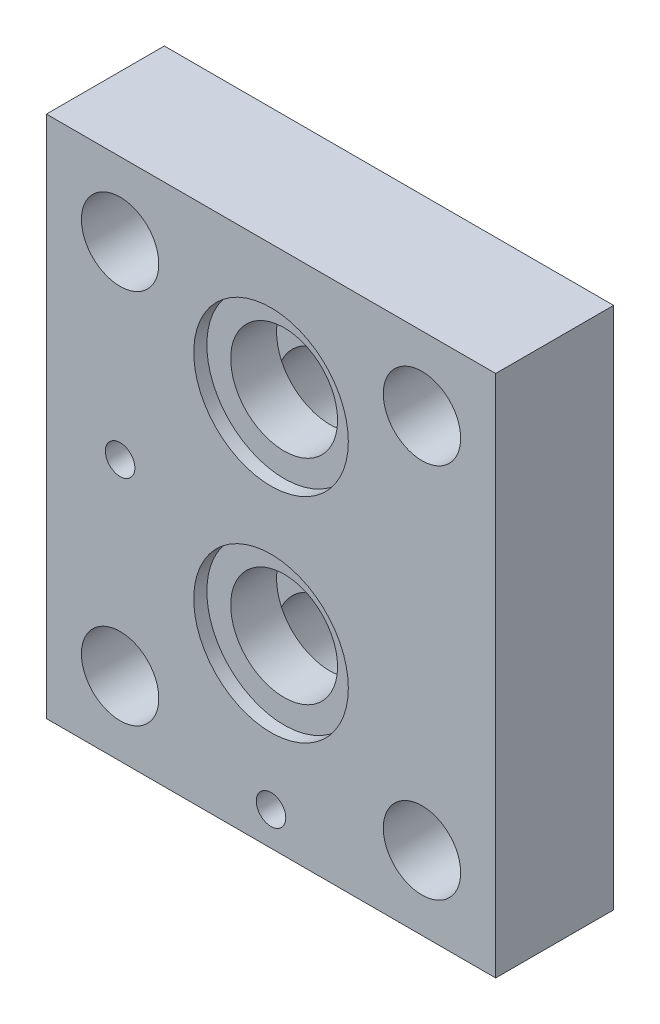
from build123d import *

# Parameters (mm, degrees)
SKETCH1_W           = 112.776
SKETCH1_H           = 96.774
BOSS_EXTRUDE1_DEPTH = 12.7
CUT_EXTRUDE2_START  = -12.7
SKETCH2_R           = 8.334375
CUT_EXTRUDE2_DEPTH  = 25.4
CUT_EXTRUDE4_START  = -12.7
SKETCH3_R           = 8.334375
CUT_EXTRUDE4_DEPTH  = 25.4
CUT_EXTRUDE6_START  = -12.7
SKETCH4_R           = 11.509375
CUT_EXTRUDE6_DEPTH  = 12.7
CUT_EXTRUDE8_START  = -12.7
SKETCH5_R           = 11.509375
CUT_EXTRUDE8_DEPTH  = 12.7
CUT_EXTRUDE10_START = 12.7
SKETCH6_R           = 11.509375
CUT_EXTRUDE10_DEPTH = 12.7
CUT_EXTRUDE12_START = 12.7
SKETCH7_R           = 11.509375
CUT_EXTRUDE12_DEPTH = 12.7
CUT_EXTRUDE14_START = 12.7
SKETCH8_R           = 16.6497
CUT_EXTRUDE14_DEPTH = 2.8194
CUT_EXTRUDE16_START = 12.7
SKETCH9_R           = 16.6497
CUT_EXTRUDE16_DEPTH = 2.8194
CUT_EXTRUDE18_START = -12.7
SKETCH10_R          = 3.571875
CUT_EXTRUDE18_DEPTH = 7.874
CUT_EXTRUDE20_START = -12.7
SKETCH11_R          = 3.571875
CUT_EXTRUDE20_DEPTH = 7.874
CUT_EXTRUDE22_START = 12.7
SKETCH12_R          = 3.175
CUT_EXTRUDE22_DEPTH = 7.874
CUT_EXTRUDE24_START = 12.7
SKETCH13_R          = 3.175
CUT_EXTRUDE24_DEPTH = 7.874


with BuildPart() as part:
    # Sketch1 → Boss-Extrude1 (new, symmetric)
    with BuildSketch(Plane(origin=(0, 0, 0), x_dir=(0, 1, 0), z_dir=(0, 0, 1))):
        Rectangle(SKETCH1_W, SKETCH1_H)
    extrude(amount=BOSS_EXTRUDE1_DEPTH, both=True)

    # Sketch2 → Cut-Extrude2 (cut)
    with BuildSketch(Plane(origin=(0, 0, 0), x_dir=(0, 1, 0), z_dir=(0, 0, 1)).offset(CUT_EXTRUDE2_START)):
        with Locations(Location((-40.513, -32.512, 0), (0, 0, 90))):
            Circle(SKETCH2_R)
    extrude(amount=CUT_EXTRUDE2_DEPTH, mode=Mode.SUBTRACT)

    # Sketch3 → Cut-Extrude4 (cut)
    with BuildSketch(Plane(origin=(0, 0, 0), x_dir=(0, 1, 0), z_dir=(0, 0, 1)).offset(CUT_EXTRUDE4_START)):
        with Locations(Location((40.513, -32.512, 0), (0, 0, 90))):
            Circle(SKETCH3_R)
        with Locations(Location((-40.513, 32.512, 0), (0, 0, 90))):
            Circle(SKETCH3_R)
        with Locations(Location((40.513, 32.512, 0), (0, 0, 90))):
            Circle(SKETCH3_R)
    extrude(amount=CUT_EXTRUDE4_DEPTH, mode=Mode.SUBTRACT)

    # Sketch4 → Cut-Extrude6 (cut)
    with BuildSketch(Plane(origin=(0, 0, 0), x_dir=(0, 1, 0), z_dir=(0, 0, 1)).offset(CUT_EXTRUDE6_START)):
        with Locations(Location((-27.813, 0, 0), (0, 0, 270))):
            Circle(SKETCH4_R)
    extrude(amount=CUT_EXTRUDE6_DEPTH, mode=Mode.SUBTRACT)

    # Sketch5 → Cut-Extrude8 (cut)
    with BuildSketch(Plane(origin=(0, 0, 0), x_dir=(0, 1, 0), z_dir=(0, 0, 1)).offset(CUT_EXTRUDE8_START)):
        with Locations(Location((18.161, 0, 0), (0, 0, 270))):
            Circle(SKETCH5_R)
    extrude(amount=CUT_EXTRUDE8_DEPTH, mode=Mode.SUBTRACT)

    # Sketch6 → Cut-Extrude10 (cut)
    with BuildSketch(Plane(origin=(0, 0, 0), x_dir=(0, 1, 0), z_dir=(0, 0, 1)).offset(CUT_EXTRUDE10_START)):
        with Locations(Location((-18.161, 0, 0), (0, 0, 270))):
            Circle(SKETCH6_R)
    extrude(amount=-CUT_EXTRUDE10_DEPTH, mode=Mode.SUBTRACT)

    # Sketch7 → Cut-Extrude12 (cut)
    with BuildSketch(Plane(origin=(0, 0, 0), x_dir=(0, 1, 0), z_dir=(0, 0, 1)).offset(CUT_EXTRUDE12_START)):
        with Locations(Location((27.813, 0, 0), (0, 0, 270))):
            Circle(SKETCH7_R)
    extrude(amount=-CUT_EXTRUDE12_DEPTH, mode=Mode.SUBTRACT)

    # Sketch8 → Cut-Extrude14 (cut)
    with BuildSketch(Plane(origin=(0, 0, 0), x_dir=(0, 1, 0), z_dir=(0, 0, 1)).offset(CUT_EXTRUDE14_START)):
        with Locations(Location((-18.161, 0, 0), (0, 0, 270))):
            Circle(SKETCH8_R)
    extrude(amount=-CUT_EXTRUDE14_DEPTH, mode=Mode.SUBTRACT)

    # Sketch9 → Cut-Extrude16 (cut)
    with BuildSketch(Plane(origin=(0, 0, 0), x_dir=(0, 1, 0), z_dir=(0, 0, 1)).offset(CUT_EXTRUDE16_START)):
        with Locations(Location((27.813, 0, 0), (0, 0, 270))):
            Circle(SKETCH9_R)
    extrude(amount=-CUT_EXTRUDE16_DEPTH, mode=Mode.SUBTRACT)

    # Sketch10 → Cut-Extrude18 (cut)
    with BuildSketch(Plane(origin=(0, 0, 0), x_dir=(0, 1, 0), z_dir=(0, 0, 1)).offset(CUT_EXTRUDE18_START)):
        with Locations(Location((49.149, 0, 0), (0, 0, 270))):
            Circle(SKETCH10_R)
    extrude(amount=CUT_EXTRUDE18_DEPTH, mode=Mode.SUBTRACT)

    # Sketch11 → Cut-Extrude20 (cut)
    with BuildSketch(Plane(origin=(0, 0, 0), x_dir=(0, 1, 0), z_dir=(0, 0, 1)).offset(CUT_EXTRUDE20_START)):
        with Locations(Location((0.127, -32.512, 0), (0, 0, 270))):
            Circle(SKETCH11_R)
    extrude(amount=CUT_EXTRUDE20_DEPTH, mode=Mode.SUBTRACT)

    # Sketch12 → Cut-Extrude22 (cut)
    with BuildSketch(Plane(origin=(0, 0, 0), x_dir=(0, 1, 0), z_dir=(0, 0, 1)).offset(CUT_EXTRUDE22_START)):
        with Locations(Location((-49.149, 0, 0), (0, 0, 270))):
            Circle(SKETCH12_R)
    extrude(amount=-CUT_EXTRUDE22_DEPTH, mode=Mode.SUBTRACT)

    # Sketch13 → Cut-Extrude24 (cut)
    with BuildSketch(Plane(origin=(0, 0, 0), x_dir=(0, 1, 0), z_dir=(0, 0, 1)).offset(CUT_EXTRUDE24_START)):
        with Locations(Location((-0.127, 32.512, 0), (0, 0, 270))):
            Circle(SKETCH13_R)
    extrude(amount=-CUT_EXTRUDE24_DEPTH, mode=Mode.SUBTRACT)


solid = part.part
